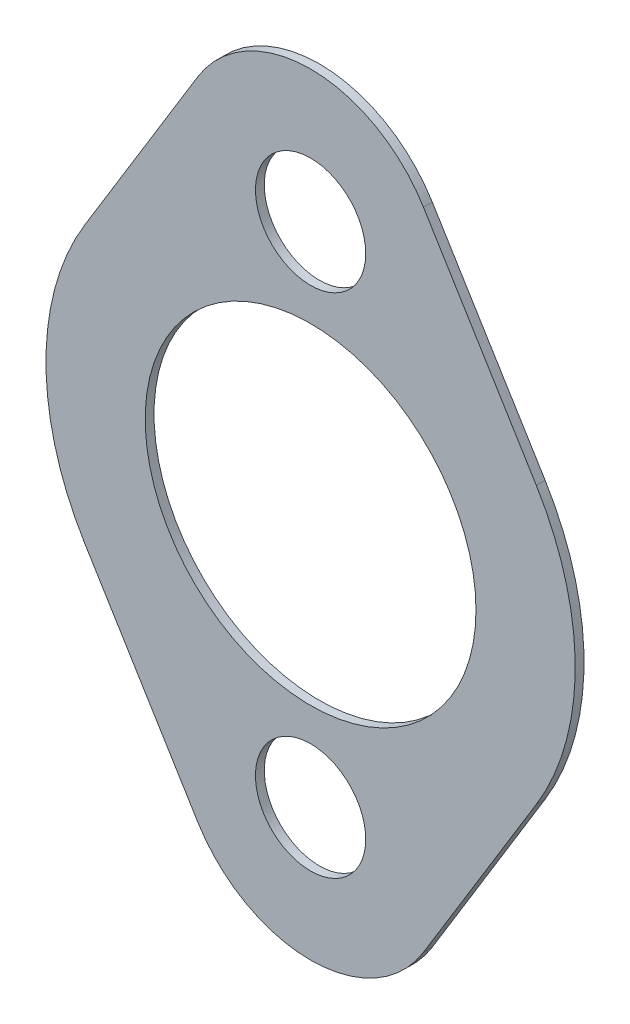
from build123d import *

# Parameters (mm, degrees)
MAIN_DEPTH  = 2
SKETCH2_R   = 12.5
SKETCH2_R_2 = 37.5
HOLES_DEPTH = 107.11432514


with BuildPart() as part:
    # Sketch1 → Main (new body)
    with BuildSketch(Plane.XY):
        with BuildLine():
            Line((25.59315244, 73.152173913), (51.186304879, 31.304347826))
            ThreePointArc((51.186304879, 31.304347826), (60, 0), (51.186304879, -31.304347826))
            Line((51.186304879, -31.304347826), (25.59315244, -73.152173913))
            ThreePointArc((25.59315244, -73.152173913), (0, -87.5), (-25.59315244, -73.152173913))
            Line((-25.59315244, -73.152173913), (-51.186304879, -31.304347826))
            ThreePointArc((-51.186304879, -31.304347826), (-60, 0), (-51.186304879, 31.304347826))
            Line((-51.186304879, 31.304347826), (-25.59315244, 73.152173913))
            ThreePointArc((-25.59315244, 73.152173913), (0, 87.5), (25.59315244, 73.152173913))
        make_face()
    extrude(amount=MAIN_DEPTH)

    # Sketch2 → Holes (cut, through all)
    with BuildSketch(Plane.XY.offset(2)):
        with Locations((0, 57.5)):
            Circle(SKETCH2_R)
        with Locations((0, -57.5)):
            Circle(SKETCH2_R)
        Circle(SKETCH2_R_2)
    extrude(amount=-HOLES_DEPTH, mode=Mode.SUBTRACT)


solid = part.part
